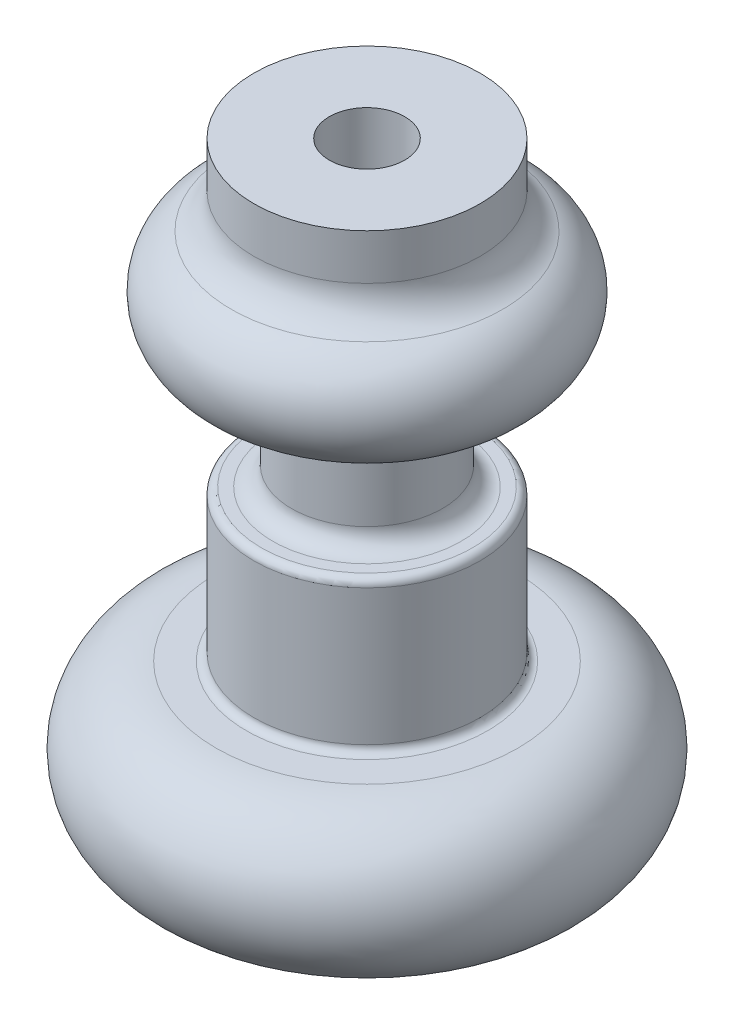
from build123d import *


with BuildPart() as part:
    # Sketch1 → Revolve1 (revolve)
    with BuildSketch(Plane.XY, mode=Mode.PRIVATE) as revolve1_sk:
        with BuildLine():
            Line((0, -95.214240608), (40, -95.214240608))
            ThreePointArc((40, -95.214240608), (60, -75.214240608), (40, -55.214240608))
            Line((40, -55.214240608), (32, -55.214240608))
            ThreePointArc((32, -55.214240608), (30.585786438, -54.62845417), (30, -53.214240608))
            Line((30, -53.214240608), (30, -17.214240608))
            ThreePointArc((30, -17.214240608), (29.414213562, -15.800027045), (28, -15.214240608))
            Line((28, -15.214240608), (25, -15.214240608))
            ThreePointArc((25, -15.214240608), (21.464466094, -13.749774514), (20, -10.214240608))
            Line((20, -10.214240608), (20, 4.785759392))
            ThreePointArc((20, 4.785759392), (22.928932188, 11.856827204), (30, 14.785759392))
            ThreePointArc((30, 14.785759392), (44.683594694, 26.721114737), (36, 43.533486477))
            ThreePointArc((36, 43.533486477), (31.633399735, 47.221412292), (30, 52.698637867))
            Line((30, 52.698637867), (30, 64.785759392))
            Line((30, 64.785759392), (10, 64.785759392))
            Line((10, 64.785759392), (10, 24.785759392))
            Line((10, 24.785759392), (0, 24.785759392))
            Line((0, 24.785759392), (0, -95.214240608))
        make_face()
    revolve(revolve1_sk.sketch.rotate(Axis((0, 0, 0), (0, 1, 0)), 90), axis=Axis((0, 0, 0), (0, 1, 0)))


solid = part.part
